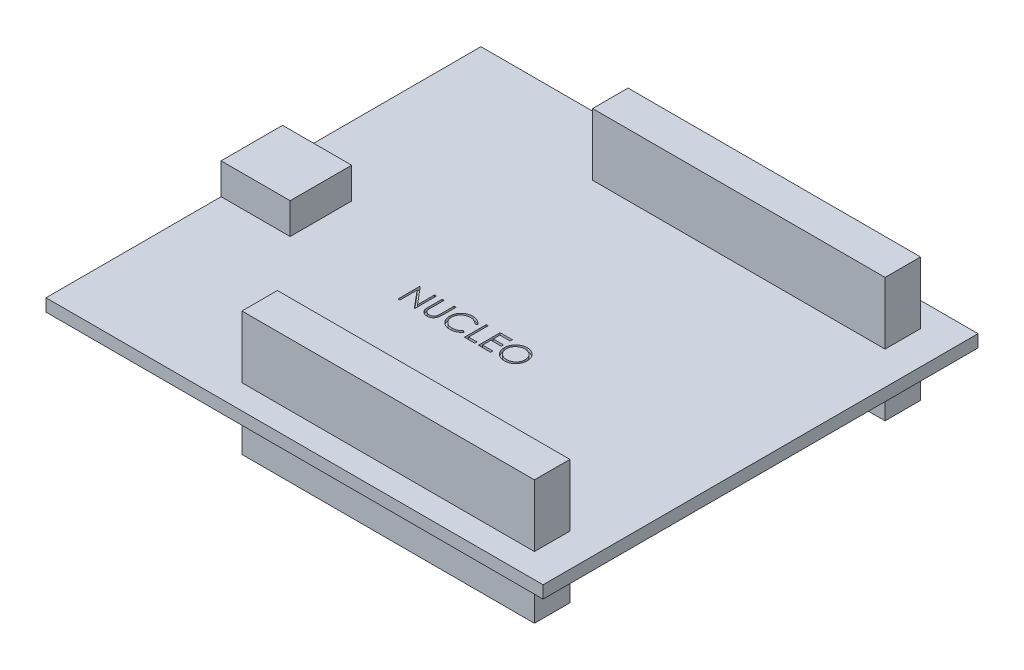
from build123d import *

# Parameters (mm, degrees)
SKETCH1_W           = 80
SKETCH1_H           = 70
BOSS_EXTRUDE1_DEPTH = 2
SKETCH2_W           = 47.073798185
SKETCH2_H           = 5.705914931
BOSS_EXTRUDE2_DEPTH = 10
SKETCH3_W           = 11.113805659
SKETCH3_H           = 9.89619621
BOSS_EXTRUDE3_DEPTH = 5
CUT_EXTRUDE1_DEPTH  = 0.5


with BuildPart() as part:
    # Sketch1 → Boss-Extrude1 (new body)
    with BuildSketch(Plane(origin=(0, 0, 0), x_dir=(1, 0, 0), z_dir=(0, 1, 0))):
        with Locations((40, 35)):
            Rectangle(SKETCH1_W, SKETCH1_H)
    extrude(amount=BOSS_EXTRUDE1_DEPTH)

    # Sketch2 → Boss-Extrude2 (add, symmetric)
    with BuildSketch(Plane(origin=(0, 2, 0), x_dir=(1, 0, 0), z_dir=(0, 1, 0))):
        with Locations((51.144365101, 6.782467566)):
            Rectangle(SKETCH2_W, SKETCH2_H)
        with Locations((51.144365101, 63.217532435)):
            Rectangle(SKETCH2_W, SKETCH2_H)
    extrude(amount=BOSS_EXTRUDE2_DEPTH, both=True)

    # Sketch3 → Boss-Extrude3 (add)
    with BuildSketch(Plane(origin=(0, 2, 0), x_dir=(1, 0, 0), z_dir=(0, 1, 0))):
        with Locations((5.55690283, 33.127746663)):
            Rectangle(SKETCH3_W, SKETCH3_H)
    extrude(amount=BOSS_EXTRUDE3_DEPTH)

    # Sketch4 → Cut-Extrude1 (cut)
    # profile 1 of 6: a face of its own
    with BuildSketch(Plane(origin=(0, 2, 0), x_dir=(1, 0, 0), z_dir=(0, 1, 0))):
        Polygon((28.487190955, 28.179648558), (28.487190955, 31.679648558), (28.553096403, 31.679648558), (30.865396083, 28.924941026), (30.865396083, 31.679648558), (31.179498647, 31.679648558), (31.179498647, 28.179648558), (31.107984224, 28.179648558), (28.801293519, 30.928045994), (28.801293519, 28.179648558), align=None)
    # profile 2 of 6: a face of its own
    with BuildSketch(Plane(origin=(0, 2, 0), x_dir=(1, 0, 0), z_dir=(0, 1, 0))):
        with BuildLine():
            Line((32.076934544, 31.679648558), (32.391037109, 31.679648558))
            Line((32.391037109, 31.679648558), (32.391037109, 29.58259327))
            add(Edge.make_bspline(
                [(32.391037109, 29.58259327), (32.390990365, 29.552912534), (32.39090166, 29.496588223), (32.391494174, 29.416419923), (32.393153542, 29.345147464), (32.394199702, 29.282496116), (32.396527035, 29.228753369), (32.398425082, 29.183628058), (32.400865639, 29.147333856), (32.403798756, 29.12615293), (32.405059544, 29.117048398)],
                knots=[0, 0, 0, 0, 1.528628734, 2.90083645, 4.128790002, 5.200304208, 6.127813768, 6.898992206, 7.526736466, 8, 8, 8, 8], degree=3))
            add(Edge.make_bspline(
                [(32.405059544, 29.117048398), (32.410237003, 29.084201635), (32.42030019, 29.020358906), (32.445946567, 28.929450624), (32.481764068, 28.847519166), (32.524207111, 28.772007874), (32.580139722, 28.705018514), (32.647143258, 28.643306862), (32.728321026, 28.589335057), (32.818581632, 28.539984245), (32.915866869, 28.500319163), (33.015278136, 28.470325798), (33.115321115, 28.452046899), (33.18229728, 28.44993036), (33.215556339, 28.448879328)],
                knots=[0, 0, 0, 0, 1.035780045, 2.013197591, 2.933192213, 3.817615948, 4.702609284, 5.640816605, 6.646850145, 7.73207398, 8.84249596, 9.914020372, 10.964143139, 12, 12, 12, 12], degree=3))
            add(Edge.make_bspline(
                [(33.215556339, 28.448879328), (33.24411008, 28.449953178), (33.301052642, 28.452094676), (33.385659072, 28.465356107), (33.468059181, 28.489256673), (33.548659861, 28.520096431), (33.624210845, 28.560844022), (33.694754287, 28.607914862), (33.757718221, 28.663125738), (33.815176219, 28.724226083), (33.865211155, 28.793165882), (33.908582297, 28.868444021), (33.944108226, 28.951193367), (33.961651751, 29.00934779), (33.970664512, 29.039223879)],
                knots=[0, 0, 0, 0, 0.994687771, 1.983630487, 2.973142513, 3.978332533, 4.983357753, 5.956394766, 6.925816176, 7.893390482, 8.871859704, 9.88551698, 10.913711441, 12, 12, 12, 12], degree=3))
            add(Edge.make_bspline(
                [(33.970664512, 29.039223879), (33.973664638, 29.051572453), (33.980350126, 29.079090053), (33.986597171, 29.125611344), (33.993103696, 29.180500708), (33.997618266, 29.244152521), (34.002019487, 29.316353493), (34.004652559, 29.397479751), (34.005869592, 29.487236712), (34.006232273, 29.549873873), (34.006421724, 29.58259327)],
                knots=[0, 0, 0, 0, 0.558680831, 1.244966039, 2.062412453, 2.990489873, 4.051219941, 5.244515665, 6.560634259, 8, 8, 8, 8], degree=3))
            Line((34.006421724, 29.58259327), (34.006421724, 31.679648558))
            Line((34.006421724, 31.679648558), (34.320524288, 31.679648558))
            Line((34.320524288, 31.679648558), (34.320524288, 29.565766347))
            add(Edge.make_bspline(
                [(34.320524288, 29.565766347), (34.320270168, 29.527667968), (34.319774236, 29.453316665), (34.31547366, 29.344365306), (34.30861666, 29.241012325), (34.298928572, 29.143243828), (34.286091569, 29.051409669), (34.271816348, 28.964704901), (34.253636815, 28.883751908), (34.232403414, 28.807919491), (34.208129866, 28.735733977), (34.176688718, 28.667225362), (34.141264218, 28.600310963), (34.099249565, 28.536002854), (34.052038182, 28.474016301), (33.998586501, 28.414727226), (33.940662341, 28.357188179), (33.877302781, 28.302875113), (33.809552256, 28.253066436), (33.737612298, 28.209268665), (33.662035528, 28.172245048), (33.583018402, 28.141769123), (33.500527199, 28.118854524), (33.41455984, 28.101779369), (33.324920646, 28.092077071), (33.26395599, 28.090635141), (33.233084384, 28.089904969)],
                knots=[0, 0, 0, 0, 1.316592851, 2.569410997, 3.76748051, 4.895814652, 5.963796859, 6.97159953, 7.931736103, 8.829262218, 9.692595152, 10.560224239, 11.431080259, 12.30701507, 13.211635791, 14.121146779, 15.063487852, 16.031507147, 17.00238618, 17.966455255, 18.938106653, 19.907068911, 20.888905087, 21.893141452, 22.933117798, 24, 24, 24, 24], degree=3))
            add(Edge.make_bspline(
                [(33.233084384, 28.089904969), (33.199415282, 28.090689734), (33.133356623, 28.092229441), (33.036018555, 28.101052191), (32.942704359, 28.117670585), (32.852428482, 28.138830529), (32.766419985, 28.168014266), (32.683526541, 28.202112391), (32.605167859, 28.243989651), (32.530072731, 28.290583044), (32.460247975, 28.343007682), (32.396150572, 28.400147856), (32.337674701, 28.461088234), (32.285806005, 28.5264886), (32.23968512, 28.595840307), (32.199954907, 28.669339546), (32.165841663, 28.746957862), (32.148235095, 28.800911063), (32.139334384, 28.828186219)],
                knots=[0, 0, 0, 0, 1.13879206, 2.234305948, 3.301075583, 4.341971843, 5.366689343, 6.369221514, 7.369726634, 8.367512178, 9.355451585, 10.318319045, 11.268648973, 12.207971039, 13.137398894, 14.081662264, 15.030215811, 16, 16, 16, 16], degree=3))
            add(Edge.make_bspline(
                [(32.139334384, 28.828186219), (32.134157226, 28.846818793), (32.122927855, 28.887233262), (32.110902557, 28.954119751), (32.100793475, 29.031134668), (32.091287917, 29.118283287), (32.085678959, 29.215633153), (32.08076152, 29.323142069), (32.076899902, 29.440940031), (32.076922674, 29.522994546), (32.076934544, 29.565766347)],
                knots=[0, 0, 0, 0, 0.625038921, 1.35572334, 2.194682327, 3.136881307, 4.189498639, 5.346923369, 6.617055217, 8, 8, 8, 8], degree=3))
            Line((32.076934544, 29.565766347), (32.076934544, 31.679648558))
        make_face()
    # profile 3 of 6: a face of its own
    with BuildSketch(Plane(origin=(0, 2, 0), x_dir=(1, 0, 0), z_dir=(0, 1, 0))):
        with BuildLine():
            Line((38.448729416, 31.037420994), (38.173889673, 30.827084456))
            add(Edge.make_bspline(
                [(38.173889673, 30.827084456), (38.154283784, 30.850450426), (38.115336337, 30.896867341), (38.052677135, 30.962046886), (37.987375492, 31.023112147), (37.919456371, 31.080354027), (37.847697251, 31.131770793), (37.773836453, 31.180041896), (37.696638407, 31.223309634), (37.589886673, 31.27577262), (37.450238825, 31.330518775), (37.274443985, 31.376422006), (37.090932887, 31.405643182), (36.965735287, 31.408808023), (36.902054737, 31.410417789)],
                knots=[0, 0, 0, 0, 0.757959112, 1.505699292, 2.245454638, 2.979532153, 3.711538275, 4.438200793, 5.171680507, 5.909471876, 7.393775596, 8.890124382, 10.418191784, 12, 12, 12, 12], degree=3))
            add(Edge.make_bspline(
                [(36.902054737, 31.410417789), (36.866971437, 31.410013827), (36.797130445, 31.409209651), (36.693481971, 31.398600526), (36.59176892, 31.383689316), (36.492057454, 31.361563992), (36.394474495, 31.333591373), (36.298382093, 31.300165959), (36.205171494, 31.25881112), (36.113553255, 31.21310286), (36.025774044, 31.161475415), (35.942718997, 31.105162063), (35.864691029, 31.044792967), (35.791628417, 30.98014186), (35.723456468, 30.9114999), (35.660669157, 30.838135558), (35.603483747, 30.760283385), (35.550766722, 30.678969977), (35.503553989, 30.594432185), (35.464024109, 30.506357115), (35.429018987, 30.416253012), (35.401319744, 30.323101851), (35.379395228, 30.227559085), (35.364267564, 30.129368297), (35.353779093, 30.028734618), (35.352978916, 29.960525305), (35.35257557, 29.926142949)],
                knots=[0, 0, 0, 0, 1.054917814, 2.100044995, 3.131103042, 4.146048494, 5.169673617, 6.183595914, 7.203665975, 8.234915748, 9.262203917, 10.264457458, 11.251630812, 12.227803204, 13.197192746, 14.159520551, 15.12972552, 16.100847026, 17.073214652, 18.039054194, 19.002613845, 19.979014051, 20.95965708, 21.949030935, 22.966165397, 24, 24, 24, 24], degree=3))
            add(Edge.make_bspline(
                [(35.35257557, 29.926142949), (35.353837389, 29.87441163), (35.356314803, 29.772844045), (35.378363137, 29.624073434), (35.411868229, 29.48155276), (35.462083806, 29.346172918), (35.524002856, 29.21626456), (35.602243468, 29.094025707), (35.692860005, 28.977609142), (35.797134425, 28.869766194), (35.911540241, 28.771252469), (36.034288152, 28.684501888), (36.16507244, 28.612187005), (36.30244907, 28.552011059), (36.447475184, 28.505754331), (36.599889986, 28.473190207), (36.759361982, 28.451948027), (36.868331382, 28.449914339), (36.923789512, 28.448879328)],
                knots=[0, 0, 0, 0, 1.029171465, 2.020641659, 2.987623507, 3.938342917, 4.889210282, 5.84687017, 6.821220943, 7.821438502, 8.827599549, 9.822697543, 10.807740252, 11.797342354, 12.80366471, 13.83203677, 14.896651826, 16, 16, 16, 16], degree=3))
            add(Edge.make_bspline(
                [(36.923789512, 28.448879328), (36.984892201, 28.450568107), (37.10515691, 28.45389203), (37.281524937, 28.482051279), (37.450360702, 28.527709197), (37.611673289, 28.591607119), (37.765007935, 28.674672407), (37.910604595, 28.775370285), (38.048586166, 28.894658617), (38.131557448, 28.985741746), (38.173889673, 29.032212661)],
                knots=[0, 0, 0, 0, 1.028121516, 2.023589091, 2.998037872, 3.967518031, 4.937445131, 5.927275754, 6.942489185, 8, 8, 8, 8], degree=3))
            Line((38.173889673, 29.032212661), (38.448729416, 28.823979488))
            add(Edge.make_bspline(
                [(38.448729416, 28.823979488), (38.426611306, 28.795441036), (38.382481031, 28.73850083), (38.311023014, 28.65822912), (38.235745717, 28.582725085), (38.156090007, 28.512597463), (38.072972215, 28.446442998), (37.984899903, 28.386141166), (37.89303087, 28.330850282), (37.797676391, 28.280223358), (37.698937779, 28.235306111), (37.596933344, 28.196852343), (37.492102768, 28.163727453), (37.38444126, 28.136475517), (37.273725503, 28.115204433), (37.160355029, 28.100984758), (37.044085154, 28.091242843), (36.965643732, 28.090354928), (36.925892878, 28.089904969)],
                knots=[0, 0, 0, 0, 0.986787822, 1.968848986, 2.935600012, 3.899624008, 4.868462664, 5.837806735, 6.815139263, 7.798259679, 8.787526145, 9.778297419, 10.776456485, 11.791383307, 12.812564526, 13.85620153, 14.913611965, 16, 16, 16, 16], degree=3))
            add(Edge.make_bspline(
                [(36.925892878, 28.089904969), (36.888249211, 28.090166961), (36.813813521, 28.090685019), (36.703914769, 28.099077187), (36.596925188, 28.110526923), (36.493150562, 28.127767054), (36.392024587, 28.148111395), (36.294464003, 28.175382651), (36.199508792, 28.205931818), (36.107540452, 28.241836805), (36.018480752, 28.282352987), (35.932616941, 28.328144546), (35.849988508, 28.378826411), (35.769783087, 28.433281421), (35.693185504, 28.493258723), (35.619531978, 28.557925357), (35.548409502, 28.627063368), (35.504406817, 28.676918222), (35.482283102, 28.701984296)],
                knots=[0, 0, 0, 0, 1.114604814, 2.203992996, 3.262667896, 4.300477797, 5.318619304, 6.316056647, 7.298880507, 8.271930387, 9.238335007, 10.195173496, 11.151986948, 12.108099108, 13.064862484, 14.031167946, 15.010108607, 16, 16, 16, 16], degree=3))
            add(Edge.make_bspline(
                [(35.482283102, 28.701984296), (35.446847459, 28.745525485), (35.376403982, 28.832082195), (35.286278298, 28.972368176), (35.209130743, 29.118836385), (35.146754822, 29.272256314), (35.097992089, 29.432283701), (35.064210894, 29.598999216), (35.04225929, 29.772247158), (35.039749001, 29.890083946), (35.038473006, 29.949981091)],
                knots=[0, 0, 0, 0, 0.994628077, 1.977248131, 2.950237994, 3.925870899, 4.908910175, 5.911660606, 6.938484602, 8, 8, 8, 8], degree=3))
            add(Edge.make_bspline(
                [(35.038473006, 29.949981091), (35.0400282, 30.012936544), (35.043087946, 30.136797469), (35.069083741, 30.318571422), (35.110902537, 30.492722821), (35.170299426, 30.658926565), (35.245604777, 30.818056846), (35.338631391, 30.96889805), (35.448298533, 31.11241485), (35.573746101, 31.246429601), (35.711313436, 31.368968954), (35.85863225, 31.476775158), (36.015414197, 31.566492674), (36.179932049, 31.641488836), (36.35341773, 31.699133299), (36.5355011, 31.739486486), (36.725840014, 31.764603602), (36.85570244, 31.76777881), (36.921686147, 31.769392148)],
                knots=[0, 0, 0, 0, 1.032925535, 2.032216505, 3.007276963, 3.968222605, 4.92396291, 5.891752235, 6.871517503, 7.883894988, 8.900124299, 9.891468569, 10.874487609, 11.85992873, 12.854644235, 13.869047385, 14.917252991, 16, 16, 16, 16], degree=3))
            add(Edge.make_bspline(
                [(36.921686147, 31.769392148), (36.961900619, 31.76891001), (37.041501116, 31.767955666), (37.159253769, 31.758649524), (37.273896096, 31.743135918), (37.385507078, 31.722019848), (37.494629694, 31.695812526), (37.600429935, 31.661672228), (37.703528622, 31.622635697), (37.80327553, 31.577677231), (37.89919208, 31.527210489), (37.991248398, 31.471794866), (38.078713257, 31.41149906), (38.162202106, 31.346835885), (38.240318317, 31.276437326), (38.315279795, 31.20223973), (38.384540873, 31.122105906), (38.427294068, 31.065700972), (38.448729416, 31.037420994)],
                knots=[0, 0, 0, 0, 1.096760587, 2.17092713, 3.219439832, 4.250915756, 5.268269357, 6.278326846, 7.281116186, 8.274029601, 9.260640565, 10.235837813, 11.203064059, 12.156899882, 13.114053108, 14.069676657, 15.032185724, 16, 16, 16, 16], degree=3))
        make_face()
    # profile 4 of 6: a face of its own
    with BuildSketch(Plane(origin=(0, 2, 0), x_dir=(1, 0, 0), z_dir=(0, 1, 0))):
        Polygon((39.166678134, 31.679648558), (39.480780698, 31.679648558), (39.480780698, 28.538622917), (40.826934544, 28.538622917), (40.826934544, 28.179648558), (39.166678134, 28.179648558), align=None)
    # profile 5 of 6: a face of its own
    with BuildSketch(Plane(origin=(0, 2, 0), x_dir=(1, 0, 0), z_dir=(0, 1, 0))):
        Polygon((41.410267878, 31.679648558), (43.384626852, 31.679648558), (43.384626852, 31.320674199), (41.724370442, 31.320674199), (41.724370442, 30.243751123), (43.384626852, 30.243751123), (43.384626852, 29.884776764), (41.724370442, 29.884776764), (41.724370442, 28.538622917), (43.384626852, 28.538622917), (43.384626852, 28.179648558), (41.410267878, 28.179648558), align=None)
    # profile 6 of 6: a face of its own
    with BuildSketch(Plane(origin=(0, 2, 0), x_dir=(1, 0, 0), z_dir=(0, 1, 0))):
        with BuildLine():
            add(Edge.make_bspline(
                [(45.650652493, 31.769392148), (45.715460599, 31.767750669), (45.842749066, 31.764526668), (46.029823964, 31.739847564), (46.208419059, 31.697152174), (46.379989198, 31.640289192), (46.542482174, 31.564434807), (46.697121067, 31.472749658), (46.843537941, 31.364273199), (46.979759322, 31.239843973), (47.104416273, 31.104460519), (47.214242159, 30.959982609), (47.306284453, 30.807283806), (47.38187024, 30.646822976), (47.441168849, 30.478963008), (47.482087893, 30.302809005), (47.508226043, 30.119502315), (47.511281821, 29.99447545), (47.51283198, 29.931050802)],
                knots=[0, 0, 0, 0, 1.065120563, 2.091984664, 3.0946048, 4.079830382, 5.057816894, 6.036188127, 7.030412546, 8.04752943, 9.064399622, 10.05169764, 11.02544977, 11.989514704, 12.962713494, 13.945757189, 14.957906945, 16, 16, 16, 16], degree=3))
            add(Edge.make_bspline(
                [(47.51283198, 29.931050802), (47.511282048, 29.868093356), (47.508226951, 29.743996935), (47.482058174, 29.561853491), (47.441017174, 29.386762795), (47.382420908, 29.219017142), (47.307195429, 29.058439578), (47.214540258, 28.905452624), (47.105399047, 28.760006126), (46.981192196, 28.623693461), (46.845791154, 28.49869599), (46.700560887, 28.389777114), (46.548767567, 28.29605299), (46.388457859, 28.221269316), (46.221757822, 28.161497395), (46.047175499, 28.120744765), (45.865528945, 28.094457722), (45.741657942, 28.091439206), (45.678697365, 28.089904969)],
                knots=[0, 0, 0, 0, 1.043624062, 2.057103931, 3.04512605, 4.022047818, 4.998200453, 5.980619268, 6.982898556, 8.009068085, 9.034988726, 10.034168286, 11.015286542, 11.987931943, 12.962482838, 13.94673481, 14.956375938, 16, 16, 16, 16], degree=3))
            add(Edge.make_bspline(
                [(45.678697365, 28.089904969), (45.615273046, 28.091454356), (45.49024683, 28.09450861), (45.306709795, 28.120690014), (45.130432051, 28.161631318), (44.9619177, 28.220140754), (44.80107277, 28.295757985), (44.647582687, 28.387962364), (44.50206354, 28.497369505), (44.365721794, 28.62153608), (44.240972595, 28.756707632), (44.13221322, 28.901541887), (44.039988106, 29.053197344), (43.964624774, 29.212094868), (43.904960315, 29.37746631), (43.864255496, 29.550414788), (43.837919544, 29.729954294), (43.834884698, 29.852197192), (43.833344801, 29.914223879)],
                knots=[0, 0, 0, 0, 1.053102029, 2.075944431, 3.073151272, 4.055350789, 5.033113405, 6.020478099, 7.024410459, 8.052272461, 9.079885166, 10.07527673, 11.055994387, 12.023226415, 12.992069828, 13.970394897, 14.97016774, 16, 16, 16, 16], degree=3))
            add(Edge.make_bspline(
                [(43.833344801, 29.914223879), (43.833879436, 29.955856548), (43.834941963, 30.038596672), (43.847733655, 30.161463272), (43.866295356, 30.28235393), (43.892897269, 30.400924878), (43.927688936, 30.516885862), (43.968740963, 30.631036625), (44.018880809, 30.742220349), (44.075561457, 30.850963741), (44.138823265, 30.955571646), (44.208699014, 31.054451229), (44.282734383, 31.148432226), (44.363897776, 31.23507923), (44.449514221, 31.316912886), (44.5409726, 31.392675604), (44.637714844, 31.463050554), (44.740157224, 31.526470896), (44.845775499, 31.58383003), (44.954652276, 31.633051881), (45.065308848, 31.675297943), (45.178263496, 31.709538768), (45.293216268, 31.736570804), (45.410418052, 31.754978158), (45.529775479, 31.767802475), (45.610186798, 31.768859977), (45.650652493, 31.769392148)],
                knots=[0, 0, 0, 0, 1.037015668, 2.060948919, 3.074880161, 4.083647147, 5.086022904, 6.090072063, 7.104153813, 8.122640571, 9.144368836, 10.147691507, 11.138137339, 12.123020368, 13.103399296, 14.087645067, 15.080126199, 16.082011238, 17.087798457, 18.072939717, 19.057185487, 20.037253025, 21.01195951, 21.997135196, 22.992090687, 24, 24, 24, 24], degree=3))
        make_face()
        with BuildLine():
            add(Edge.make_bspline(
                [(45.666077173, 31.410417789), (45.632862539, 31.410012899), (45.566750806, 31.409206989), (45.46846627, 31.398591274), (45.371474336, 31.383461385), (45.275754974, 31.361879864), (45.181708685, 31.332475811), (45.088458843, 31.298634903), (44.996855789, 31.257413812), (44.907201932, 31.210841108), (44.820286856, 31.159292187), (44.738274155, 31.10232042), (44.660951511, 31.041261866), (44.588508244, 30.975974029), (44.521157072, 30.906124427), (44.457572371, 30.832771991), (44.400302789, 30.7538201), (44.347817212, 30.671409693), (44.300849372, 30.585648112), (44.259084017, 30.497438249), (44.224920009, 30.406060562), (44.197057632, 30.312506405), (44.173957821, 30.216923945), (44.159323897, 30.118588096), (44.148591538, 30.017992984), (44.147831692, 29.95001113), (44.147447365, 29.915626123)],
                knots=[0, 0, 0, 0, 1.008559885, 2.007477868, 2.99961109, 3.989939068, 4.984837346, 5.991145699, 7.001802488, 8.033829008, 9.059044045, 10.069351652, 11.065060232, 12.050310815, 13.029377138, 14.011219647, 14.996725999, 15.989392538, 16.977580475, 17.965360261, 18.951710183, 19.937753436, 20.929683414, 21.935841486, 22.955955122, 24, 24, 24, 24], degree=3))
            add(Edge.make_bspline(
                [(44.147447365, 29.915626123), (44.148722227, 29.865063902), (44.151230275, 29.765592372), (44.173187845, 29.619824228), (44.207009819, 29.479735941), (44.256867186, 29.346094032), (44.3192178, 29.217749749), (44.396244691, 29.095841644), (44.487503776, 28.98033677), (44.591167303, 28.872041501), (44.704490009, 28.773195697), (44.824822739, 28.686432288), (44.950876347, 28.613022038), (45.08297955, 28.553216966), (45.220427089, 28.505827228), (45.36410464, 28.473348597), (45.513055099, 28.451973142), (45.614585754, 28.449920386), (45.666077173, 28.448879328)],
                knots=[0, 0, 0, 0, 1.032063989, 2.030389145, 3.003944642, 3.970395727, 4.937377036, 5.913328081, 6.909231446, 7.93887556, 8.970685674, 9.976071282, 10.964166581, 11.944589148, 12.933237628, 13.927779006, 14.949070134, 16, 16, 16, 16], degree=3))
            add(Edge.make_bspline(
                [(45.666077173, 28.448879328), (45.700686674, 28.449354832), (45.769327711, 28.4502979), (45.871423233, 28.459796577), (45.971679445, 28.475028446), (46.069955725, 28.496959102), (46.166140536, 28.524406308), (46.260635339, 28.557014036), (46.352433629, 28.59769524), (46.442693467, 28.642643192), (46.529089709, 28.693883349), (46.611565241, 28.748921499), (46.688041221, 28.809890119), (46.760430292, 28.874207932), (46.828057981, 28.94317178), (46.890466966, 29.016692002), (46.947447098, 29.095232659), (46.999912744, 29.177518065), (47.046716007, 29.263514317), (47.087495106, 29.352043995), (47.122091222, 29.442889105), (47.150019727, 29.536180676), (47.171905189, 29.631741525), (47.186985108, 29.729699603), (47.197533547, 29.829858946), (47.198328624, 29.897602802), (47.198729416, 29.931751924)],
                knots=[0, 0, 0, 0, 1.047197238, 2.076906641, 3.100256066, 4.114471768, 5.12198147, 6.126382909, 7.136867548, 8.15857795, 9.17633901, 10.174870724, 11.156907918, 12.133735059, 13.104061851, 14.077631395, 15.04955518, 16.038496417, 17.029181396, 18.010275684, 18.986308667, 19.968651475, 20.955262928, 21.950658345, 22.966943676, 24, 24, 24, 24], degree=3))
            add(Edge.make_bspline(
                [(47.198729416, 29.931751924), (47.198328303, 29.965667428), (47.197532622, 30.032945078), (47.186990147, 30.132405897), (47.171889257, 30.229659108), (47.150126549, 30.324322911), (47.122076395, 30.416421436), (47.087489065, 30.505868184), (47.046703765, 30.592996379), (46.999895541, 30.677590676), (46.947279717, 30.758765414), (46.889785474, 30.836367826), (46.826420126, 30.908940568), (46.758994101, 30.978275262), (46.685823216, 31.042893151), (46.607238922, 31.102815672), (46.524195244, 31.159488946), (46.436268008, 31.210614508), (46.345524055, 31.257828741), (46.252410097, 31.298279744), (46.157980997, 31.332651863), (46.062476885, 31.361968829), (45.965093906, 31.383376859), (45.866490078, 31.398604909), (45.766801819, 31.409203294), (45.699758599, 31.410011673), (45.666077173, 31.410417789)],
                knots=[0, 0, 0, 0, 1.02996197, 2.043119294, 3.035359645, 4.018872909, 4.991431989, 5.957985074, 6.929999688, 7.912076566, 8.892894881, 9.867085534, 10.843653904, 11.817741046, 12.803660682, 13.806313499, 14.818574707, 15.856120519, 16.894564902, 17.924820532, 18.937903209, 19.946497019, 20.957711757, 21.963978472, 22.977135795, 24, 24, 24, 24], degree=3))
        make_face(mode=Mode.SUBTRACT)
    extrude(amount=-CUT_EXTRUDE1_DEPTH, mode=Mode.SUBTRACT)


solid = part.part
